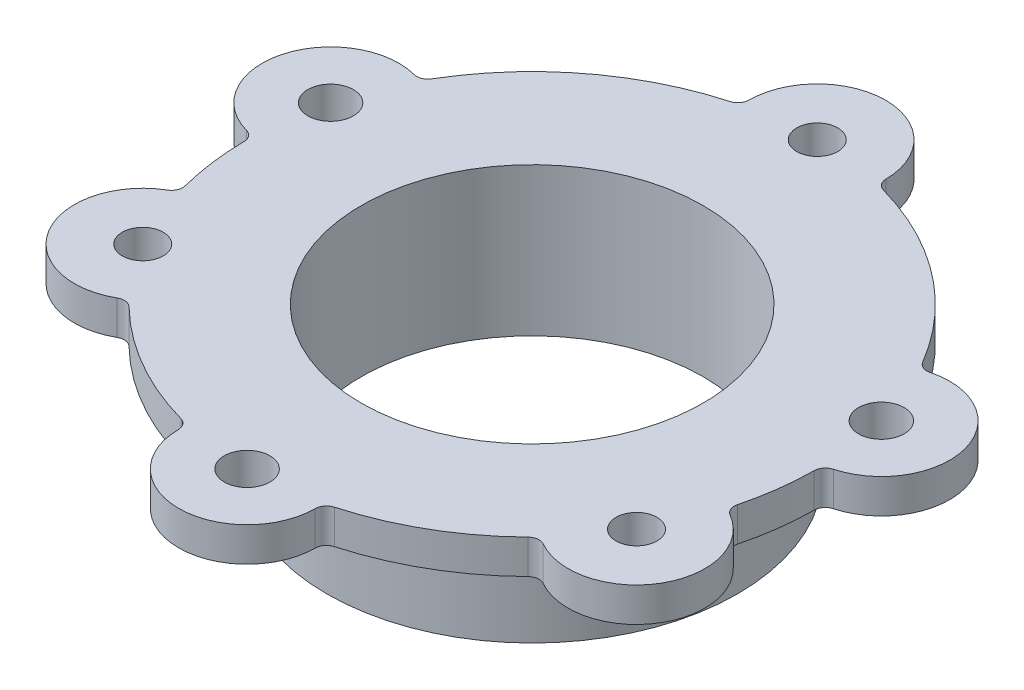
from build123d import *

# Parameters (mm, degrees)
BOSS_EXTRUDE1_DEPTH = 1.5
FILLET1_R           = 0.5
BOSS_EXTRUDE2_START = 5
SKETCH2_R           = 9
SKETCH2_R_2         = 7.5
BOSS_EXTRUDE2_DEPTH = 5


with BuildPart() as part:
    # Sketch1 → Boss-Extrude1 (new body)
    with BuildSketch(Plane(origin=(0, 0, 0), x_dir=(1, 0, 0), z_dir=(0, 1, 0))):
        with BuildLine():
            ThreePointArc((0.899416611, 12.4676), (1.956802124, 12.345886985), (3, 12.1346611))
            Line((3, 12.1346611), (3, 12.5))
            ThreePointArc((3, 12.5), (0, 15.5), (-3, 12.5))
            Line((-3, 12.5), (-3, 12.1346611))
            ThreePointArc((-3, 12.1346611), (-1.956802124, 12.345886985), (-0.899416611, 12.4676))
            ThreePointArc((-0.899416611, 12.4676), (-0.016202626, 13.399854141), (0.9, 12.5))
            ThreePointArc((0.9, 12.5), (0.899854141, 12.483797374), (0.899416611, 12.4676))
        make_face()
        with BuildLine():
            ThreePointArc((-3, 6.873863542), (0, 7.5), (3, 6.873863542))
            Line((3, 6.873863542), (3, 12.1346611))
            ThreePointArc((3, 12.1346611), (1.956802124, 12.345886985), (0.899416611, 12.4676))
            ThreePointArc((0.899416611, 12.4676), (0, 11.6), (-0.899416611, 12.4676))
            ThreePointArc((-0.899416611, 12.4676), (-1.956802124, 12.345886985), (-3, 12.1346611))
            Line((-3, 12.1346611), (-3, 6.873863542))
        make_face()
        with BuildLine():
            Line((3, 12.1346611), (3, 6.873863542))
            ThreePointArc((3, 6.873863542), (4.565710718, 5.950150052), (5.863185187, 4.676864277))
            Line((5.863185187, 4.676864277), (10.944725414, 6.038458877))
            ThreePointArc((10.944725414, 6.038458877), (7.609517863, 9.916916754), (3, 12.1346611))
        make_face()
        with BuildLine():
            ThreePointArc((7.5, 0), (7.48822587, -0.420087268), (7.45294045, -0.83885556))
            Line((7.45294045, -0.83885556), (7.772310826, -1.023244132))
            Line((7.772310826, -1.023244132), (12.497639685, 0.24290392))
            ThreePointArc((12.497639685, 0.24290392), (12.43679381, 1.255451998), (12.294047703, 2.259732526))
            ThreePointArc((12.294047703, 2.259732526), (11.108147002, 2.976419019), (11.776823889, 4.190038078))
            ThreePointArc((11.776823889, 4.190038078), (11.39830538, 5.131143582), (10.944725414, 6.038458877))
            Line((10.944725414, 6.038458877), (5.863185187, 4.676864277))
            ThreePointArc((5.863185187, 4.676864277), (7.078979054, 2.477509949), (7.5, 0))
        make_face()
        with BuildLine():
            ThreePointArc((12.294047703, 2.259732526), (12.43679381, 1.255451998), (12.497639685, 0.24290392))
            Line((12.497639685, 0.24290392), (12.850529964, 0.337460585))
            ThreePointArc((12.850529964, 0.337460585), (14.971850307, 4.011695199), (11.297615693, 6.133015543))
            Line((11.297615693, 6.133015543), (10.944725414, 6.038458877))
            ThreePointArc((10.944725414, 6.038458877), (11.39830538, 5.131143582), (11.776823889, 4.190038078))
            ThreePointArc((11.776823889, 4.190038078), (12.666842202, 4.040610319), (13.074072829, 3.235238064))
            ThreePointArc((13.074072829, 3.235238064), (12.855089754, 2.610728206), (12.294047703, 2.259732526))
        make_face()
        with BuildLine():
            Line((12.497639685, 0.24290392), (7.772310826, -1.023244132))
            Line((7.772310826, -1.023244132), (12.008924778, -3.469254338))
            ThreePointArc((12.008924778, -3.469254338), (12.376622312, -1.751918986), (12.5, 0))
            ThreePointArc((12.5, 0), (12.499409907, 0.121457693), (12.497639685, 0.24290392))
        make_face()
        with BuildLine():
            ThreePointArc((7.45294045, -0.83885556), (7.43583646, -0.978946442), (7.416099457, -1.118690681))
            Line((7.416099457, -1.118690681), (7.772310826, -1.023244132))
            Line((7.772310826, -1.023244132), (7.45294045, -0.83885556))
        make_face()
        with BuildLine():
            Line((7.772310826, -1.023244132), (7.416099457, -1.118690681))
            ThreePointArc((7.416099457, -1.118690681), (6.42347811, -3.871553818), (4.45294045, -6.035007983))
            Line((4.45294045, -6.035007983), (9.008924778, -8.665406761))
            ThreePointArc((9.008924778, -8.665406761), (9.713450699, -7.867583842), (10.347550019, -7.012717634))
            ThreePointArc((10.347550019, -7.012717634), (10.045894684, -5.8), (11.24696663, -5.454882366))
            ThreePointArc((11.24696663, -5.454882366), (11.670252823, -4.478303143), (12.008924778, -3.469254338))
            Line((12.008924778, -3.469254338), (7.772310826, -1.023244132))
        make_face()
        with BuildLine():
            ThreePointArc((10.347550019, -7.012717634), (9.713450699, -7.867583842), (9.008924778, -8.665406761))
            Line((9.008924778, -8.665406761), (9.325317547, -8.848076211))
            ThreePointArc((9.325317547, -8.848076211), (13.423393759, -7.75), (12.325317547, -3.651923789))
            Line((12.325317547, -3.651923789), (12.008924778, -3.469254338))
            ThreePointArc((12.008924778, -3.469254338), (11.670252823, -4.478303143), (11.24696663, -5.454882366))
            ThreePointArc((11.24696663, -5.454882366), (11.59651278, -5.786041044), (11.725317547, -6.25))
            ThreePointArc((11.725317547, -6.25), (11.261212732, -7.037397859), (10.347550019, -7.012717634))
        make_face()
        with BuildLine():
            ThreePointArc((4.45294045, -6.035007983), (3.75, -6.495190528), (3, -6.873863542))
            Line((3, -6.873863542), (3, -12.1346611))
            ThreePointArc((3, -12.1346611), (6.25, -10.825317547), (9.008924778, -8.665406761))
            Line((9.008924778, -8.665406761), (4.45294045, -6.035007983))
        make_face()
        with BuildLine():
            Line((3, -12.1346611), (3, -6.873863542))
            ThreePointArc((3, -6.873863542), (0, -7.5), (-3, -6.873863542))
            Line((-3, -6.873863542), (-3, -12.1346611))
            ThreePointArc((-3, -12.1346611), (-2.00620559, -12.337955225), (-0.99919968, -12.46))
            ThreePointArc((-0.99919968, -12.46), (0, -11.5), (0.99919968, -12.46))
            ThreePointArc((0.99919968, -12.46), (2.00620559, -12.337955225), (3, -12.1346611))
        make_face()
        with BuildLine():
            Line((3, -12.5), (3, -12.1346611))
            ThreePointArc((3, -12.1346611), (2.00620559, -12.337955225), (0.99919968, -12.46))
            ThreePointArc((0.99919968, -12.46), (0.9997999, -12.479995997), (1, -12.5))
            ThreePointArc((1, -12.5), (-0.020004003, -13.4997999), (-0.99919968, -12.46))
            ThreePointArc((-0.99919968, -12.46), (-2.00620559, -12.337955225), (-3, -12.1346611))
            Line((-3, -12.1346611), (-3, -12.5))
            ThreePointArc((-3, -12.5), (0, -15.5), (3, -12.5))
        make_face()
        with BuildLine():
            Line((-3, -12.1346611), (-3, -6.873863542))
            ThreePointArc((-3, -6.873863542), (-3.75, -6.495190528), (-4.45294045, -6.035007983))
            Line((-4.45294045, -6.035007983), (-9.008924778, -8.665406761))
            ThreePointArc((-9.008924778, -8.665406761), (-6.25, -10.825317547), (-3, -12.1346611))
        make_face()
        with BuildLine():
            Line((-9.008924778, -8.665406761), (-4.45294045, -6.035007983))
            ThreePointArc((-4.45294045, -6.035007983), (-6.42347811, -3.871553818), (-7.416099457, -1.118690681))
            Line((-7.416099457, -1.118690681), (-7.772310826, -1.023244132))
            Line((-7.772310826, -1.023244132), (-12.008924778, -3.469254338))
            ThreePointArc((-12.008924778, -3.469254338), (-11.670252823, -4.478303143), (-11.24696663, -5.454882366))
            ThreePointArc((-11.24696663, -5.454882366), (-10.361358591, -5.478804767), (-9.925317547, -6.25))
            ThreePointArc((-9.925317547, -6.25), (-10.037919689, -6.685895185), (-10.347550019, -7.012717634))
            ThreePointArc((-10.347550019, -7.012717634), (-9.713450699, -7.867583842), (-9.008924778, -8.665406761))
        make_face()
        with BuildLine():
            Line((-9.325317547, -8.848076211), (-9.008924778, -8.665406761))
            ThreePointArc((-9.008924778, -8.665406761), (-9.713450699, -7.867583842), (-10.347550019, -7.012717634))
            ThreePointArc((-10.347550019, -7.012717634), (-11.604740411, -6.7), (-11.24696663, -5.454882366))
            ThreePointArc((-11.24696663, -5.454882366), (-11.670252823, -4.478303143), (-12.008924778, -3.469254338))
            Line((-12.008924778, -3.469254338), (-12.325317547, -3.651923789))
            ThreePointArc((-12.325317547, -3.651923789), (-13.423393759, -7.75), (-9.325317547, -8.848076211))
        make_face()
        with BuildLine():
            Line((-7.772310826, -1.023244132), (-7.416099457, -1.118690681))
            ThreePointArc((-7.416099457, -1.118690681), (-7.43583646, -0.978946442), (-7.45294045, -0.83885556))
            Line((-7.45294045, -0.83885556), (-7.772310826, -1.023244132))
        make_face()
        with BuildLine():
            Line((-12.008924778, -3.469254338), (-7.772310826, -1.023244132))
            Line((-7.772310826, -1.023244132), (-12.497639685, 0.24290392))
            ThreePointArc((-12.497639685, 0.24290392), (-12.393060767, -1.631577403), (-12.008924778, -3.469254338))
        make_face()
        with BuildLine():
            ThreePointArc((-7.45294045, -0.83885556), (-7.206635264, 2.07711535), (-5.863185187, 4.676864277))
            Line((-5.863185187, 4.676864277), (-10.944725414, 6.038458877))
            ThreePointArc((-10.944725414, 6.038458877), (-11.39830538, 5.131143582), (-11.776823889, 4.190038078))
            ThreePointArc((-11.776823889, 4.190038078), (-11.268700573, 3.828007437), (-11.074072829, 3.235238064))
            ThreePointArc((-11.074072829, 3.235238064), (-11.44956297, 2.454221139), (-12.294047703, 2.259732526))
            ThreePointArc((-12.294047703, 2.259732526), (-12.43679381, 1.255451998), (-12.497639685, 0.24290392))
            Line((-12.497639685, 0.24290392), (-7.772310826, -1.023244132))
            Line((-7.772310826, -1.023244132), (-7.45294045, -0.83885556))
        make_face()
        with BuildLine():
            ThreePointArc((-11.776823889, 4.190038078), (-11.39830538, 5.131143582), (-10.944725414, 6.038458877))
            Line((-10.944725414, 6.038458877), (-11.297615693, 6.133015543))
            ThreePointArc((-11.297615693, 6.133015543), (-14.971850307, 4.011695199), (-12.850529964, 0.337460585))
            Line((-12.850529964, 0.337460585), (-12.497639685, 0.24290392))
            ThreePointArc((-12.497639685, 0.24290392), (-12.43679381, 1.255451998), (-12.294047703, 2.259732526))
            ThreePointArc((-12.294047703, 2.259732526), (-13.039998655, 3.494057109), (-11.776823889, 4.190038078))
        make_face()
        with BuildLine():
            ThreePointArc((-5.863185187, 4.676864277), (-4.565710718, 5.950150052), (-3, 6.873863542))
            Line((-3, 6.873863542), (-3, 12.1346611))
            ThreePointArc((-3, 12.1346611), (-7.609517863, 9.916916754), (-10.944725414, 6.038458877))
            Line((-10.944725414, 6.038458877), (-5.863185187, 4.676864277))
        make_face()
    extrude(amount=BOSS_EXTRUDE1_DEPTH)

    # Fillet1
    fillet1_edges = [part.edges().sort_by_distance(p)[0] for p in [
        (-3, 0.75, 12.1346611),
        (3, 0.75, 12.1346611),
        (9.008924778, 0.75, 8.665406761),
        (12.008924778, 0.75, 3.469254338),
        (12.497639685, 0.75, -0.24290392),
        (10.944725414, 0.75, -6.038458877),
        (3, 0.75, -12.1346611),
        (-3, 0.75, -12.1346611),
        (-10.944725414, 0.75, -6.038458877),
        (-12.497639685, 0.75, -0.24290392),
        (-12.008924778, 0.75, 3.469254338),
        (-9.008924778, 0.75, 8.665406761),
    ]]
    fillet(fillet1_edges, radius=FILLET1_R)

    # Sketch2 → Boss-Extrude2 (add)
    with BuildSketch(Plane.XZ.offset(BOSS_EXTRUDE2_START)):
        with Locations(Location((0, 0, 0), (0, 0, 90))):
            Circle(SKETCH2_R)
        with Locations(Location((0, 0, 0), (0, 0, 270))):
            Circle(SKETCH2_R_2, mode=Mode.SUBTRACT)
    extrude(amount=-BOSS_EXTRUDE2_DEPTH)


solid = part.part
